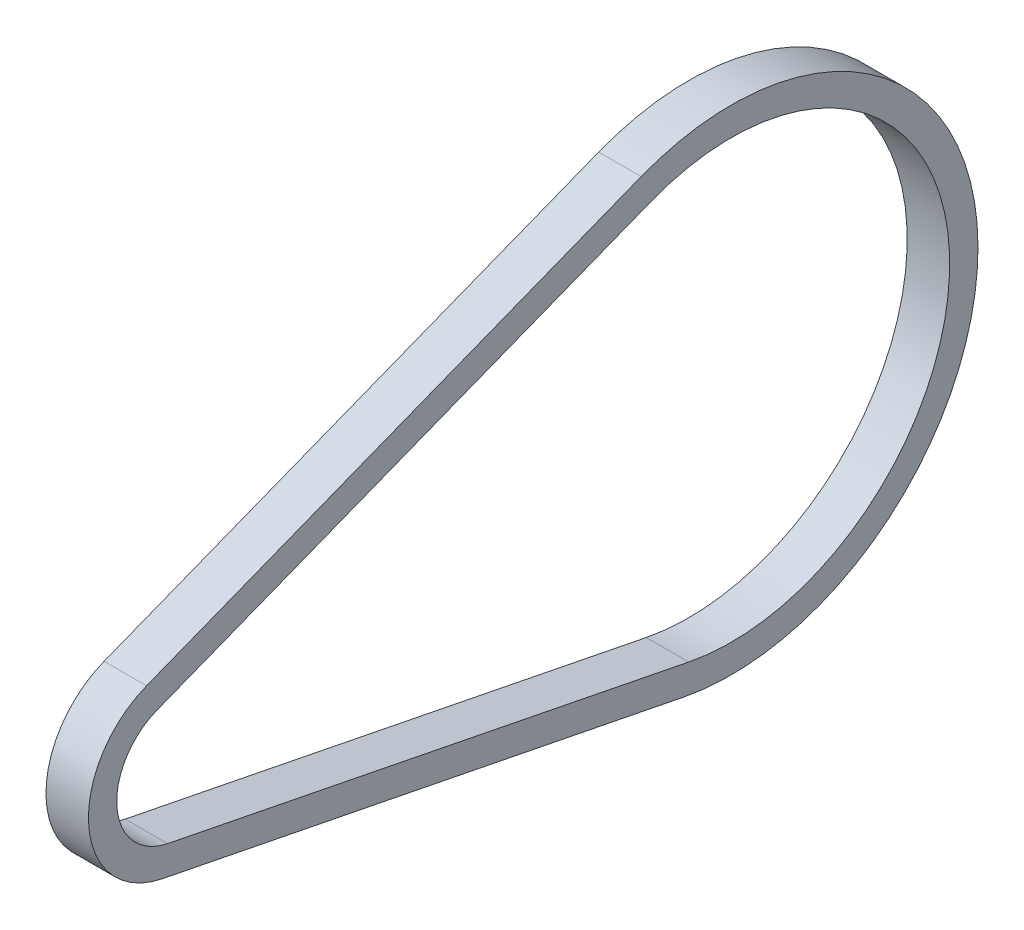
from build123d import *

# Parameters (mm, degrees)
EXTRUDE_THIN1_DEPTH = 7.62


with BuildPart() as part:
    # Sketch1 → Extrude-Thin1 (new, symmetric)
    with BuildSketch(Plane.ZY.offset(-110.25)):
        with BuildLine():
            Line((-615.614704462, 170.984199418), (-802.597206958, 133.923548514))
            ThreePointArc((-802.597206958, 133.923548514), (-908.053927045, 228.674152785), (-787.513709868, 303.298899781))
            Line((-787.513709868, 303.298899781), (-610.022461239, 233.780522747))
            ThreePointArc((-610.022461239, 233.780522747), (-589.286960141, 200.286783656), (-615.614704462, 170.984199418))
        make_face()
        with BuildLine():
            Line((-617.590029198, 180.950326659), (-804.572531695, 143.889675755))
            ThreePointArc((-804.572531695, 143.889675755), (-897.933976221, 227.772933997), (-791.21902444, 293.838654333))
            Line((-791.21902444, 293.838654333), (-613.72777581, 224.320277299))
            ThreePointArc((-613.72777581, 224.320277299), (-599.406910966, 201.188002445), (-617.590029198, 180.950326659))
        make_face(mode=Mode.SUBTRACT)
    extrude(amount=EXTRUDE_THIN1_DEPTH, both=True)


solid = part.part
